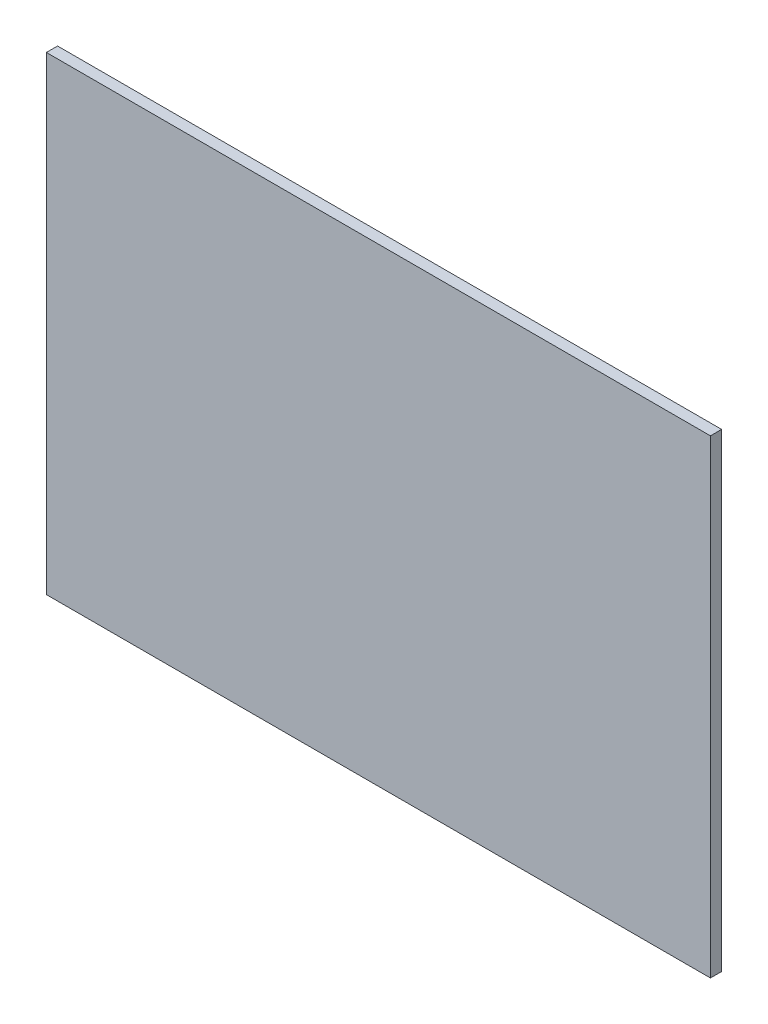
from build123d import *

# Parameters (mm, degrees)
SKETCH1_W           = 297
SKETCH1_H           = 210
BOSS_EXTRUDE1_DEPTH = 5


with BuildPart() as part:
    # Sketch1 → Boss-Extrude1 (new body)
    with BuildSketch(Plane.XY):
        with Locations((-148.5, -105)):
            Rectangle(SKETCH1_W, SKETCH1_H)
    extrude(amount=BOSS_EXTRUDE1_DEPTH)


solid = part.part
